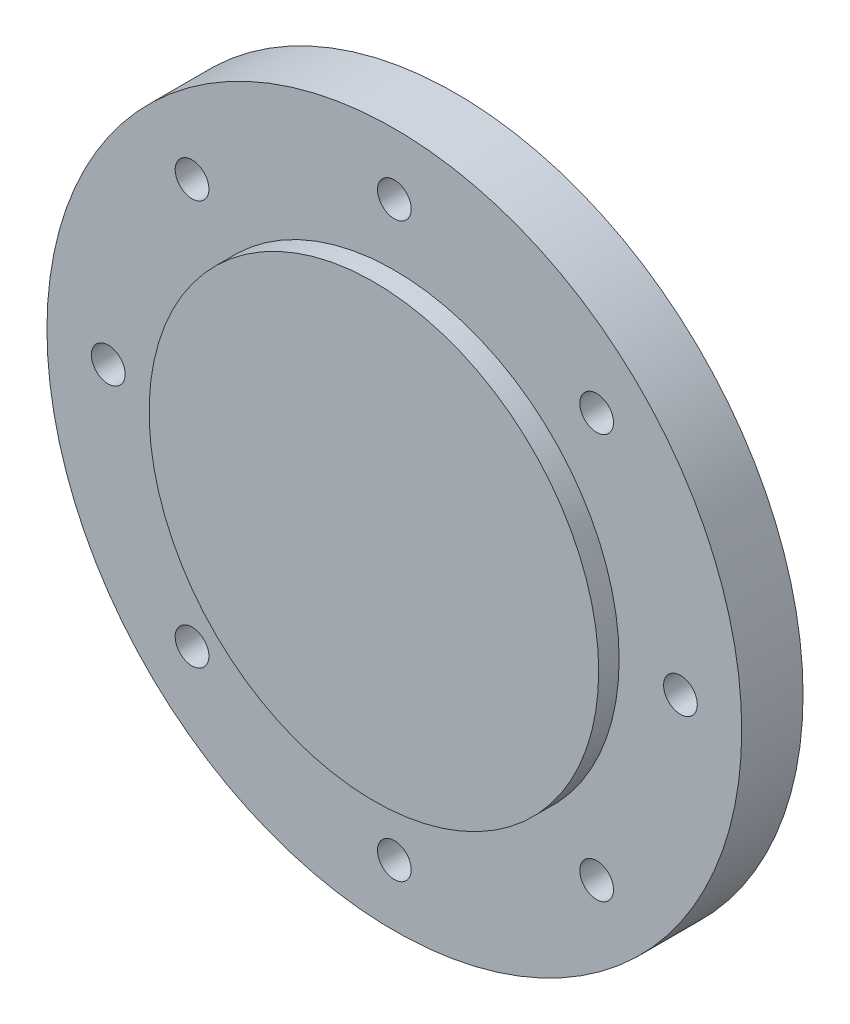
from build123d import *

# Parameters (mm, degrees)
SK_DISC_R                 = 34
OUTPUT_DISC_DEPTH         = 6
SK_PILOT_R                = 22
PILOT_BOSS_DEPTH          = 2
SK_OUTHOLE_R              = 1.65
OUTPUT_TAPPED_HOLE_DEPTH  = 6
OUTPUT_HOLE_PATTERN_COUNT = 8


with BuildPart() as part:
    # SK_Disc → Output_Disc (new body)
    with BuildSketch(Plane.XY):
        Circle(SK_DISC_R)
    extrude(amount=OUTPUT_DISC_DEPTH)

    # SK_Pilot → Pilot_Boss (add)
    with BuildSketch(Plane.XY.offset(6)):
        Circle(SK_PILOT_R)
    extrude(amount=PILOT_BOSS_DEPTH)

    # SK_OutHole → Output_Tapped_Hole (cut)
    with BuildSketch(Plane.XY.offset(6)):
        with Locations((28, 0)):
            Circle(SK_OUTHOLE_R)
    output_tapped_hole = extrude(amount=-OUTPUT_TAPPED_HOLE_DEPTH, mode=Mode.SUBTRACT)

    # Output_Hole_Pattern: Output_Tapped_Hole ×8 about axis
    output_hole_pattern_axis = Axis((0, 0, -0.4), (0, 0, 1))
    for i in range(1, OUTPUT_HOLE_PATTERN_COUNT):
        add(output_tapped_hole.rotate(output_hole_pattern_axis, i * 360 / OUTPUT_HOLE_PATTERN_COUNT), mode=Mode.SUBTRACT)


solid = part.part
